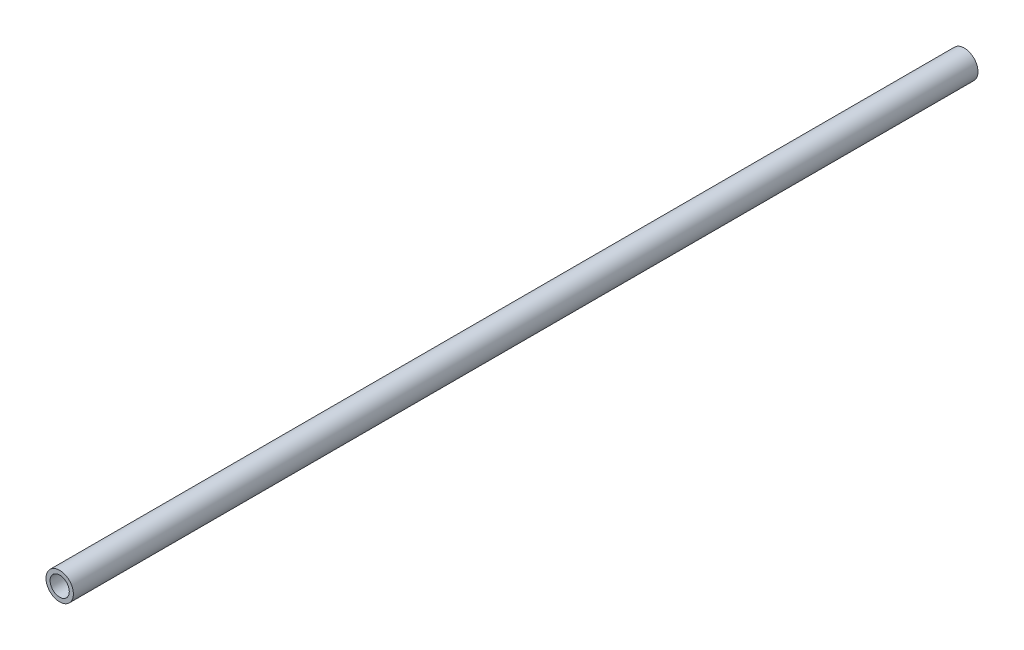
from build123d import *

# Parameters (mm, degrees)
SKETCH_1_R      = 5
SKETCH_1_R_2    = 3.5
EXTRUDE_1_DEPTH = 165


with BuildPart() as part:
    # 草图1 → 凸台-拉伸1 (new, symmetric)
    with BuildSketch(Plane.XY):
        Circle(SKETCH_1_R)
        Circle(SKETCH_1_R_2, mode=Mode.SUBTRACT)
    extrude(amount=EXTRUDE_1_DEPTH, both=True)


solid = part.part
